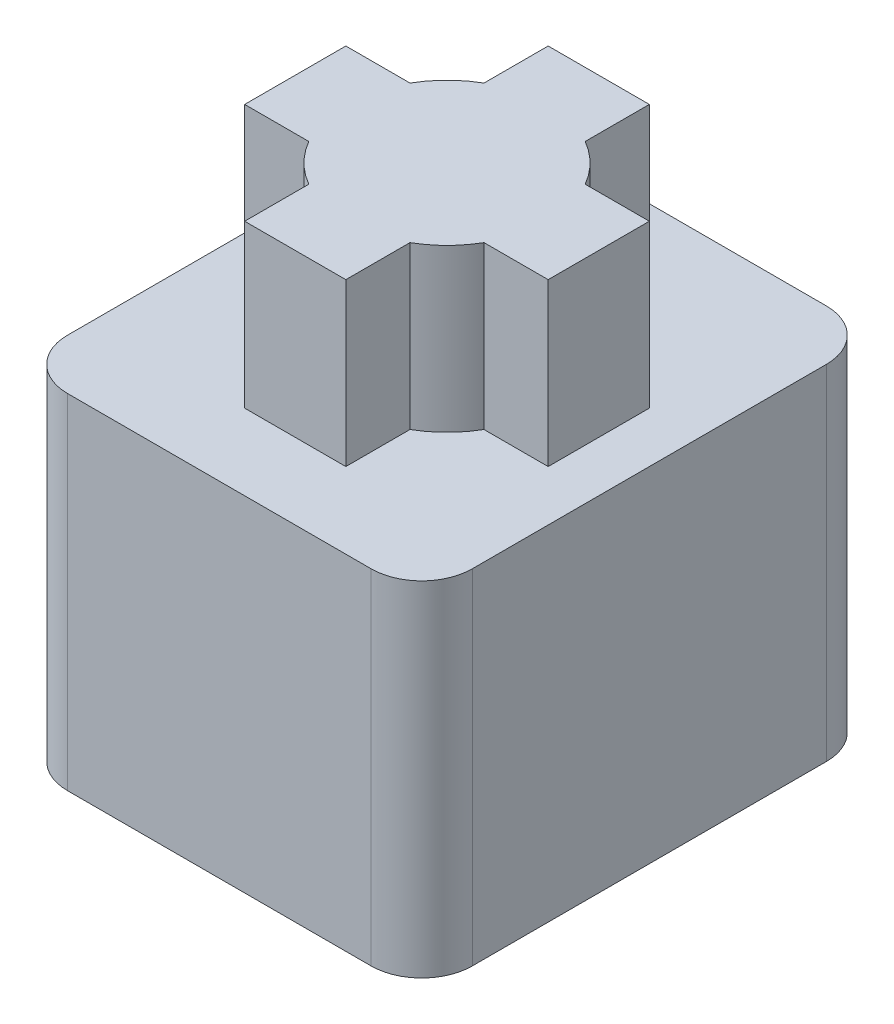
from build123d import *

# Parameters (mm, degrees)
SKETCH2_W           = 8
SKETCH2_H           = 9
BOSS_EXTRUDE1_DEPTH = 6.8
FILLET1_R           = 1
SKETCH3_W           = 2
SKETCH3_H           = 2
BOSS_EXTRUDE2_DEPTH = 3.2


with BuildPart() as part:
    # Sketch2 → Boss-Extrude1 (new body)
    with BuildSketch(Plane(origin=(0, 0, 0), x_dir=(1, 0, 0), z_dir=(0, 1, 0))):
        with Locations((4, 4.5)):
            Rectangle(SKETCH2_W, SKETCH2_H)
    extrude(amount=BOSS_EXTRUDE1_DEPTH)

    # Fillet1
    fillet1_edges = [part.edges().sort_by_distance(p)[0] for p in [
        (0, 3.4, -9),
        (8, 3.4, -9),
        (8, 3.4, 0),
        (0, 3.4, 0),
    ]]
    fillet(fillet1_edges, radius=FILLET1_R)

    # Sketch3 → Boss-Extrude2 (add)
    with BuildSketch(Plane(origin=(0, 6.8, 0), x_dir=(1, 0, 0), z_dir=(0, 1, 0))):
        with Locations((4, 4.5)):
            Rectangle(SKETCH3_W, SKETCH3_H)
        with BuildLine():
            Line((3, 3.5), (3, 5.5))
            Line((3, 5.5), (2.267949192, 5.5))
            ThreePointArc((2.267949192, 5.5), (2, 4.5), (2.267949192, 3.5))
            Line((2.267949192, 3.5), (3, 3.5))
        make_face()
        with BuildLine():
            Line((3, 5.5), (3, 6.232050808))
            ThreePointArc((3, 6.232050808), (2.585786438, 5.914213562), (2.267949192, 5.5))
            Line((2.267949192, 5.5), (3, 5.5))
        make_face()
        with BuildLine():
            ThreePointArc((5, 6.232050808), (4, 6.5), (3, 6.232050808))
            Line((3, 6.232050808), (3, 5.5))
            Line((3, 5.5), (5, 5.5))
            Line((5, 5.5), (5, 6.232050808))
        make_face()
        with BuildLine():
            Line((5.732050808, 5.5), (5, 5.5))
            Line((5, 5.5), (5, 3.5))
            Line((5, 3.5), (5.732050808, 3.5))
            ThreePointArc((5.732050808, 3.5), (5.931851653, 3.98236191), (6, 4.5))
            ThreePointArc((6, 4.5), (5.931851653, 5.01763809), (5.732050808, 5.5))
        make_face()
        with BuildLine():
            ThreePointArc((5.732050808, 5.5), (5.414213562, 5.914213562), (5, 6.232050808))
            Line((5, 6.232050808), (5, 5.5))
            Line((5, 5.5), (5.732050808, 5.5))
        make_face()
        with BuildLine():
            Line((5, 3.5), (3, 3.5))
            Line((3, 3.5), (3, 2.767949192))
            ThreePointArc((3, 2.767949192), (4, 2.5), (5, 2.767949192))
            Line((5, 2.767949192), (5, 3.5))
        make_face()
        with BuildLine():
            Line((5.732050808, 3.5), (5, 3.5))
            Line((5, 3.5), (5, 2.767949192))
            ThreePointArc((5, 2.767949192), (5.414213562, 3.085786438), (5.732050808, 3.5))
        make_face()
        with BuildLine():
            Line((3, 2.767949192), (3, 3.5))
            Line((3, 3.5), (2.267949192, 3.5))
            ThreePointArc((2.267949192, 3.5), (2.585786438, 3.085786438), (3, 2.767949192))
        make_face()
        with BuildLine():
            ThreePointArc((5, 2.767949192), (4, 2.5), (3, 2.767949192))
            Line((3, 2.767949192), (3, 1.5))
            Line((3, 1.5), (5, 1.5))
            Line((5, 1.5), (5, 2.767949192))
        make_face()
        with BuildLine():
            ThreePointArc((2.267949192, 3.5), (2, 4.5), (2.267949192, 5.5))
            Line((2.267949192, 5.5), (1, 5.5))
            Line((1, 5.5), (1, 3.5))
            Line((1, 3.5), (2.267949192, 3.5))
        make_face()
        with BuildLine():
            Line((5, 7.5), (3, 7.5))
            Line((3, 7.5), (3, 6.232050808))
            ThreePointArc((3, 6.232050808), (4, 6.5), (5, 6.232050808))
            Line((5, 6.232050808), (5, 7.5))
        make_face()
        with BuildLine():
            Line((7, 5.5), (5.732050808, 5.5))
            ThreePointArc((5.732050808, 5.5), (5.931851653, 5.01763809), (6, 4.5))
            ThreePointArc((6, 4.5), (5.931851653, 3.98236191), (5.732050808, 3.5))
            Line((5.732050808, 3.5), (7, 3.5))
            Line((7, 3.5), (7, 5.5))
        make_face()
    extrude(amount=BOSS_EXTRUDE2_DEPTH)


solid = part.part
